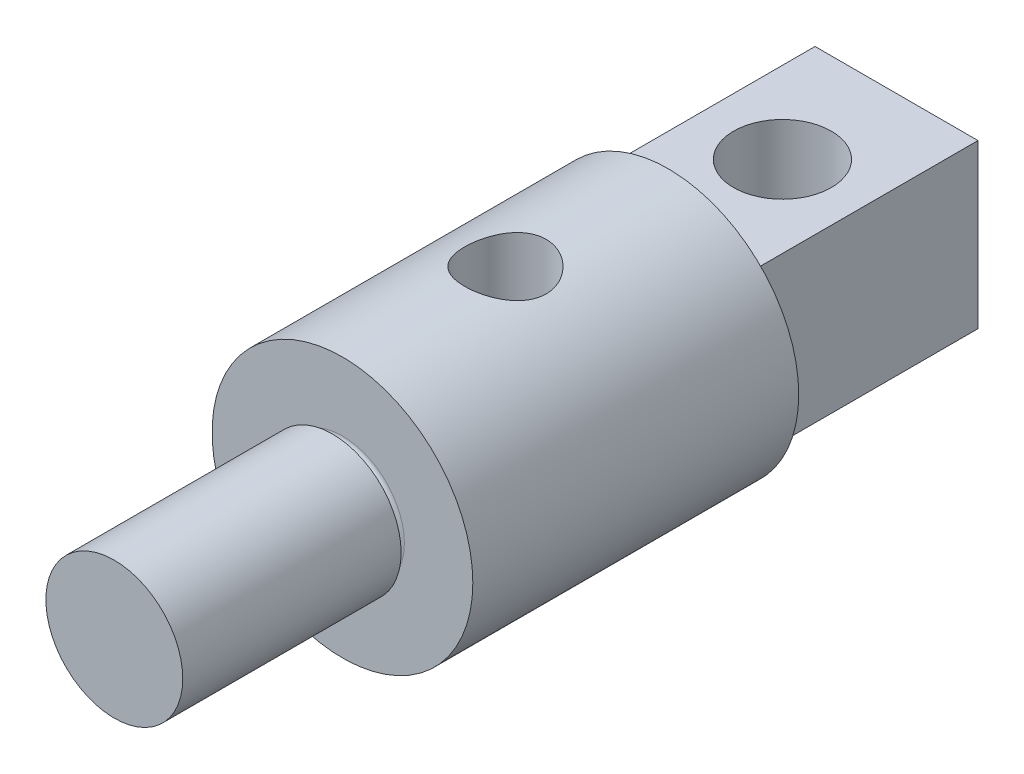
from build123d import *

# Parameters (mm, degrees)
SKETCH_1_W               = 50
SKETCH_1_H               = 50
EXTRUDE_1_DEPTH          = 70
SKETCH_2_R               = 40
EXTRUDE_2_DEPTH          = 100
SKETCH_3_R               = 21
EXTRUDE_3_DEPTH          = 70
SKETCH_5_R               = 15
CUT_EXTRUDE_1_DEPTH      = 252.843205189
CUT_EXTRUDE_2_DEPTH      = 50
CUT_EXTRUDE_2_DEPTH_BACK = 50
SKETCH_6_R               = 12.5
CUT_EXTRUDE_START        = -8
CUT_EXTRUDE_3_DEPTH      = 239.576560151
SKETCH_10_W              = 4
SKETCH_10_H              = 3
FILLET_1_R               = 2


with BuildPart() as part:
    # Эскиз1 → Бобышка-Вытянуть1 (new body)
    with BuildSketch(Plane.XY):
        Rectangle(SKETCH_1_W, SKETCH_1_H)
    extrude(amount=EXTRUDE_1_DEPTH)

    # Эскиз2 → Бобышка-Вытянуть2 (add)
    with BuildSketch(Plane.XY.offset(70)):
        Circle(SKETCH_2_R)
    extrude(amount=EXTRUDE_2_DEPTH)

    # Эскиз3 → Бобышка-Вытянуть3 (add)
    with BuildSketch(Plane.XY.offset(170)):
        Circle(SKETCH_3_R)
    extrude(amount=EXTRUDE_3_DEPTH)

    # Эскиз5 → Вырез-Вытянуть1 (cut, through all)
    with BuildSketch(Plane.XZ.offset(25)):
        with Locations((0, 35)):
            Circle(SKETCH_5_R)
    extrude(amount=-CUT_EXTRUDE_1_DEPTH, mode=Mode.SUBTRACT)

    # Эскиз6 → Вырез-Вытянуть2 (cut, two sides: drawn at the far end of the back side and taken through both)
    with BuildSketch(Plane(origin=(0, 0, 0), x_dir=(1, 0, 0), z_dir=(0, 1, 0)).offset(-CUT_EXTRUDE_2_DEPTH_BACK)):
        with Locations((0, -120)):
            Circle(SKETCH_6_R)
    extrude(amount=CUT_EXTRUDE_2_DEPTH + CUT_EXTRUDE_2_DEPTH_BACK, mode=Mode.SUBTRACT)

    # Эскиз7 → Вырез-Повернуть1 (revolve, cut)
    with BuildSketch(Plane(origin=(0, 0, 0), x_dir=(1, 0, 0), z_dir=(0, 1, 0))):
        Polygon((-40, -120), (-40, -112), (-22, -112), (-17.381197846, -120), align=None)
    revolve(axis=Axis((-40, 0, 120), (1, 0, 0)), mode=Mode.SUBTRACT)

    # Эскиз8 → Вырез-Вытянуть3 (cut, through all)
    with BuildSketch(Plane(origin=(0, 0, 0), x_dir=(0, 0, -1), z_dir=(1, 0, 0)).offset(CUT_EXTRUDE_START)):
        with BuildLine():
            Line((-228, 5), (-206, 5))
            ThreePointArc((-206, 5), (-201, 0), (-206, -5))
            Line((-206, -5), (-228, -5))
            ThreePointArc((-228, -5), (-233, 0), (-228, 5))
        make_face()
    extrude(amount=-CUT_EXTRUDE_3_DEPTH, mode=Mode.SUBTRACT)

    # Эскиз10 → Вырез-Повернуть2 (revolve, cut)
    with BuildSketch(Plane(origin=(0, 0, 0), x_dir=(1, 0, 0), z_dir=(0, 1, 0))):
        with Locations((-19, -171.5)):
            Rectangle(SKETCH_10_W, SKETCH_10_H)
    revolve(axis=Axis((0, 0, 240), (0, 0, -1)), mode=Mode.SUBTRACT)

    # Скругление1
    fillet_1_edges = [part.edges().sort_by_distance(p)[0] for p in [
        (17, 0, 170),
    ]]
    fillet(fillet_1_edges, radius=FILLET_1_R)


solid = part.part
